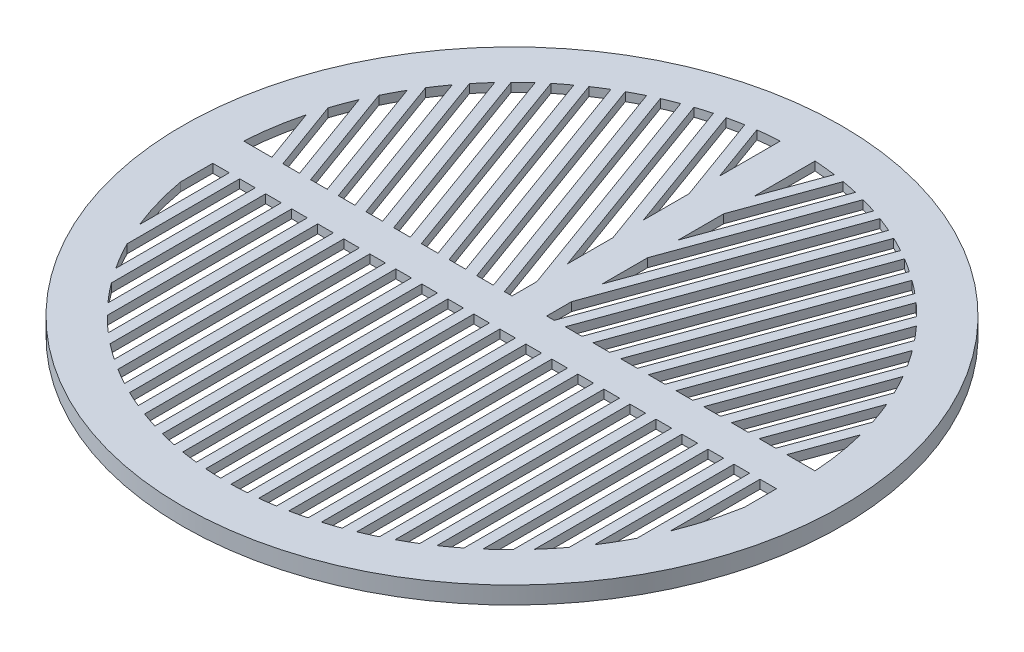
from build123d import *

# Parameters (mm, degrees)
SKETCH1_R           = 36
BOSS_EXTRUDE1_DEPTH = 1
BOSS_EXTRUDE2_START = -1
BOSS_EXTRUDE2_DEPTH = 1
BOSS_EXTRUDE3_START = -1
BOSS_EXTRUDE3_DEPTH = 1
BOSS_EXTRUDE4_START = -2
SKETCH4_R           = 38
SKETCH4_R_2         = 36
BOSS_EXTRUDE4_DEPTH = 2


with BuildPart() as part:
    # Sketch1 → Boss-Extrude1 (new body)
    with BuildSketch(Plane(origin=(0, 0, 0), x_dir=(1, 0, 0), z_dir=(0, 1, 0))):
        with Locations(Location((0, 0, 0), (0, 0, 270))):
            Circle(SKETCH1_R)
        with BuildLine():
            Line((2, 2), (2, 32.939338184))
            ThreePointArc((2, 32.939338184), (23.334523779, 23.334523779), (32.939338184, 2))
            Line((32.939338184, 2), (2, 2))
        make_face(mode=Mode.SUBTRACT)
        with BuildLine():
            Line((-2, 2), (-2, 32.939338184))
            ThreePointArc((-2, 32.939338184), (-23.334523779, 23.334523779), (-32.939338184, 2))
            Line((-32.939338184, 2), (-2, 2))
        make_face(mode=Mode.SUBTRACT)
        with BuildLine():
            Line((32.939338184, -2), (-32.939338184, -2))
            ThreePointArc((-32.939338184, -2), (0, -33), (32.939338184, -2))
        make_face(mode=Mode.SUBTRACT)
    extrude(amount=BOSS_EXTRUDE1_DEPTH)

    # Sketch2 → Boss-Extrude2 (add)
    with BuildSketch(Plane(origin=(0, 1, 0), x_dir=(1, 0, 0), z_dir=(0, 1, 0)).offset(BOSS_EXTRUDE2_START)):
        with BuildLine():
            Line((-31.956512753, 8.232939492), (-29.687908306, 2))
            Line((-29.687908306, 2), (-28.410894979, 2))
            Line((-28.410894979, 2), (-31.389437355, 10.183477921))
            ThreePointArc((-31.389437355, 10.183477921), (-31.687986664, 9.212572996), (-31.956512753, 8.232939492))
        make_face()
        with BuildLine():
            Line((-30.421702183, 12.787495309), (-26.495374988, 2))
            Line((-26.495374988, 2), (-25.218361661, 2))
            Line((-25.218361661, 2), (-29.714780359, 14.35380884))
            ThreePointArc((-29.714780359, 14.35380884), (-30.078438584, 13.575254412), (-30.421702183, 12.787495309))
        make_face()
        with BuildLine():
            Line((-28.579802314, 16.49833021), (-23.302841671, 2))
            Line((-23.302841671, 2), (-22.025828344, 2))
            Line((-22.025828344, 2), (-27.780618223, 17.811155245))
            ThreePointArc((-27.780618223, 17.811155245), (-28.187854267, 17.159396022), (-28.579802314, 16.49833021))
        make_face()
        with BuildLine():
            Line((-26.526953666, 19.629588105), (-20.110308353, 2))
            Line((-20.110308353, 2), (-18.833295026, 2))
            Line((-18.833295026, 2), (-25.658450811, 20.751961401))
            ThreePointArc((-25.658450811, 20.751961401), (-26.098736379, 20.195444027), (-26.526953666, 19.629588105))
        make_face()
        with BuildLine():
            Line((-24.311688326, 22.314609805), (-16.917775036, 2))
            Line((-16.917775036, 2), (-15.640761709, 2))
            Line((-15.640761709, 2), (-23.386817294, 23.282112809))
            ThreePointArc((-23.386817294, 23.282112809), (-23.854158445, 22.80305078), (-24.311688326, 22.314609805))
        make_face()
        with BuildLine():
            Line((-21.962103276, 24.630591136), (-13.725241719, 2))
            Line((-13.725241719, 2), (-12.448228392, 2))
            Line((-12.448228392, 2), (-20.988814522, 25.465067543))
            ThreePointArc((-20.988814522, 25.465067543), (-21.479511695, 25.052556304), (-21.962103276, 24.630591136))
        make_face()
        with BuildLine():
            Line((-9.255695074, 2), (-18.479032108, 27.340910233))
            ThreePointArc((-18.479032108, 27.340910233), (-18.990719237, 26.988008131), (-19.495668696, 26.62553102))
            Line((-19.495668696, 26.62553102), (-10.532708401, 2))
            Line((-10.532708401, 2), (-9.255695074, 2))
        make_face()
        with BuildLine():
            Line((-16.923542291, 28.330085004), (-7.340175084, 2))
            Line((-7.340175084, 2), (-6.063161757, 2))
            Line((-6.063161757, 2), (-15.866771351, 28.935195989))
            ThreePointArc((-15.866771351, 28.935195989), (-16.397948256, 28.637515482), (-16.923542291, 28.330085004))
        make_face()
        with BuildLine():
            Line((-14.252696944, 29.763410924), (-4.147641766, 2))
            Line((-4.147641766, 2), (-2.870628439, 2))
            Line((-2.870628439, 2), (-13.157677627, 30.263435355))
            ThreePointArc((-13.157677627, 30.263435355), (-13.707467477, 30.018416603), (-14.252696944, 29.763410924))
        make_face()
        with BuildLine():
            Line((-11.48702296, 30.936197302), (-2, 4.870815942))
            Line((-2, 4.870815942), (-2, 8.379381223))
            Line((-2, 8.379381223), (-10.354583355, 31.33341034))
            ThreePointArc((-10.354583355, 31.33341034), (-10.922608944, 31.139952053), (-11.48702296, 30.936197302))
        make_face()
        with BuildLine():
            Line((-8.627871314, 31.852155917), (-2, 13.642229143))
            Line((-2, 13.642229143), (-2, 17.150794423))
            Line((-2, 17.150794423), (-7.457890846, 32.146226281))
            ThreePointArc((-7.457890846, 32.146226281), (-8.044224973, 32.004537875), (-8.627871314, 31.852155917))
        make_face()
        with BuildLine():
            Line((-2, 25.922207624), (-4.465624559, 32.696455424))
            ThreePointArc((-4.465624559, 32.696455424), (-5.070798475, 32.608081864), (-5.674230694, 32.50850821))
            Line((-5.674230694, 32.50850821), (-2, 22.413642343))
            Line((-2, 22.413642343), (-2, 25.922207624))
        make_face()
    boss_extrude2 = extrude(amount=BOSS_EXTRUDE2_DEPTH)

    # Mirror1: Boss-Extrude2 across plane
    add(boss_extrude2.mirror(Plane(origin=(0, 0, 0), x_dir=(0, 0, 1), z_dir=(1, 0, 0))))

    # Sketch3 → Boss-Extrude3 (add)
    with BuildSketch(Plane(origin=(0, 1, 0), x_dir=(1, 0, 0), z_dir=(0, 1, 0)).offset(BOSS_EXTRUDE3_START)):
        with BuildLine():
            Line((-0.6, -2), (-0.6, -32.994545004))
            ThreePointArc((-0.6, -32.994545004), (0, -33), (0.6, -32.994545004))
            Line((0.6, -32.994545004), (0.6, -2))
            Line((0.6, -2), (-0.6, -2))
        make_face()
        with BuildLine():
            Line((2.4, -2), (2.4, -32.912611565))
            ThreePointArc((2.4, -32.912611565), (3.000500126, -32.863307791), (3.6, -32.803048639))
            Line((3.6, -32.803048639), (3.6, -2))
            Line((3.6, -2), (2.4, -2))
        make_face()
        with BuildLine():
            Line((5.4, -2), (5.4, -32.555183919))
            ThreePointArc((5.4, -32.555183919), (6.001025916, -32.44977177), (6.6, -32.333264605))
            Line((6.6, -32.333264605), (6.6, -2))
            Line((6.6, -2), (5.4, -2))
        make_face()
        with BuildLine():
            Line((8.4, -2), (8.4, -31.913006753))
            ThreePointArc((8.4, -31.913006753), (9.00160762, -31.748559971), (9.6, -31.572773081))
            Line((9.6, -31.572773081), (9.6, -2))
            Line((9.6, -2), (8.4, -2))
        make_face()
        with BuildLine():
            Line((11.4, -2), (11.4, -30.968370961))
            ThreePointArc((11.4, -30.968370961), (12.0022865, -30.739959642), (12.6, -30.499836065))
            Line((12.6, -30.499836065), (12.6, -2))
            Line((12.6, -2), (11.4, -2))
        make_face()
        with BuildLine():
            Line((14.4, -2), (14.4, -29.692423276))
            ThreePointArc((14.4, -29.692423276), (15.003126316, -29.392281312), (15.6, -29.079889959))
            Line((15.6, -29.079889959), (15.6, -2))
            Line((15.6, -2), (14.4, -2))
        make_face()
        with BuildLine():
            Line((17.4, -2), (17.4, -28.039971469))
            ThreePointArc((17.4, -28.039971469), (18.004237635, -27.655875093), (18.6, -27.25876006))
            Line((18.6, -27.25876006), (18.6, -2))
            Line((18.6, -2), (17.4, -2))
        make_face()
        with BuildLine():
            Line((20.4, -2), (20.4, -25.939159585))
            ThreePointArc((20.4, -25.939159585), (21.005837975, -25.451026914), (21.6, -24.948747464))
            Line((21.6, -24.948747464), (21.6, -2))
            Line((21.6, -2), (20.4, -2))
        make_face()
        with BuildLine():
            Line((23.4, -2), (23.4, -23.268863316))
            ThreePointArc((23.4, -23.268863316), (24.008432145, -22.640565054), (24.6, -21.996363336))
            Line((24.6, -21.996363336), (24.6, -2))
            Line((24.6, -2), (23.4, -2))
        make_face()
        with BuildLine():
            Line((26.4, -2), (26.4, -19.8))
            ThreePointArc((26.4, -19.8), (27.013537651, -18.954386921), (27.6, -18.089776118))
            Line((27.6, -18.089776118), (27.6, -2))
            Line((27.6, -2), (26.4, -2))
        make_face()
        with BuildLine():
            Line((29.4, -2), (29.4, -14.987995196))
            ThreePointArc((29.4, -14.987995196), (30.028877551, -13.684535544), (30.6, -12.354756169))
            Line((30.6, -12.354756169), (30.6, -2))
            Line((30.6, -2), (29.4, -2))
        make_face()
        with BuildLine():
            Line((32.5, -2), (32.5, -5.722761571))
            ThreePointArc((32.5, -5.722761571), (32.772572129, -3.867624087), (32.939338184, -2))
            Line((32.939338184, -2), (32.5, -2))
        make_face()
        with BuildLine():
            Line((-3.6, -2), (-3.6, -32.803048639))
            ThreePointArc((-3.6, -32.803048639), (-3.000500126, -32.863307791), (-2.4, -32.912611565))
            Line((-2.4, -32.912611565), (-2.4, -2))
            Line((-2.4, -2), (-3.6, -2))
        make_face()
        with BuildLine():
            Line((-6.6, -2), (-6.6, -32.333264605))
            ThreePointArc((-6.6, -32.333264605), (-6.001025916, -32.44977177), (-5.4, -32.555183919))
            Line((-5.4, -32.555183919), (-5.4, -2))
            Line((-5.4, -2), (-6.6, -2))
        make_face()
        with BuildLine():
            Line((-9.6, -2), (-9.6, -31.572773081))
            ThreePointArc((-9.6, -31.572773081), (-9.00160762, -31.748559971), (-8.4, -31.913006753))
            Line((-8.4, -31.913006753), (-8.4, -2))
            Line((-8.4, -2), (-9.6, -2))
        make_face()
        with BuildLine():
            Line((-12.6, -2), (-12.6, -30.499836065))
            ThreePointArc((-12.6, -30.499836065), (-12.0022865, -30.739959642), (-11.4, -30.968370961))
            Line((-11.4, -30.968370961), (-11.4, -2))
            Line((-11.4, -2), (-12.6, -2))
        make_face()
        with BuildLine():
            Line((-15.6, -2), (-15.6, -29.079889959))
            ThreePointArc((-15.6, -29.079889959), (-15.003126316, -29.392281312), (-14.4, -29.692423276))
            Line((-14.4, -29.692423276), (-14.4, -2))
            Line((-14.4, -2), (-15.6, -2))
        make_face()
        with BuildLine():
            Line((-18.6, -2), (-18.6, -27.25876006))
            ThreePointArc((-18.6, -27.25876006), (-18.004237635, -27.655875093), (-17.4, -28.039971469))
            Line((-17.4, -28.039971469), (-17.4, -2))
            Line((-17.4, -2), (-18.6, -2))
        make_face()
        with BuildLine():
            Line((-21.6, -2), (-21.6, -24.948747464))
            ThreePointArc((-21.6, -24.948747464), (-21.005837975, -25.451026914), (-20.4, -25.939159585))
            Line((-20.4, -25.939159585), (-20.4, -2))
            Line((-20.4, -2), (-21.6, -2))
        make_face()
        with BuildLine():
            Line((-24.6, -2), (-24.6, -21.996363336))
            ThreePointArc((-24.6, -21.996363336), (-24.008432145, -22.640565054), (-23.4, -23.268863316))
            Line((-23.4, -23.268863316), (-23.4, -2))
            Line((-23.4, -2), (-24.6, -2))
        make_face()
        with BuildLine():
            Line((-27.6, -2), (-27.6, -18.089776118))
            ThreePointArc((-27.6, -18.089776118), (-27.013537651, -18.954386921), (-26.4, -19.8))
            Line((-26.4, -19.8), (-26.4, -2))
            Line((-26.4, -2), (-27.6, -2))
        make_face()
        with BuildLine():
            Line((-30.6, -2), (-30.6, -12.354756169))
            ThreePointArc((-30.6, -12.354756169), (-30.028877551, -13.684535544), (-29.4, -14.987995196))
            Line((-29.4, -14.987995196), (-29.4, -2))
            Line((-29.4, -2), (-30.6, -2))
        make_face()
        with BuildLine():
            Line((-32.5, -2), (-32.5, -5.722761571))
            ThreePointArc((-32.5, -5.722761571), (-32.772572129, -3.867624087), (-32.939338184, -2))
            Line((-32.939338184, -2), (-32.5, -2))
        make_face()
    extrude(amount=BOSS_EXTRUDE3_DEPTH)

    # Sketch4 → Boss-Extrude4 (add)
    with BuildSketch(Plane(origin=(0, 1, 0), x_dir=(1, 0, 0), z_dir=(0, 1, 0)).offset(BOSS_EXTRUDE4_START)):
        with Locations(Location((0, 0, 0), (0, 0, 270))):
            Circle(SKETCH4_R)
        with Locations(Location((0, 0, 0), (0, 0, 270))):
            Circle(SKETCH4_R_2, mode=Mode.SUBTRACT)
    extrude(amount=BOSS_EXTRUDE4_DEPTH)


solid = part.part
